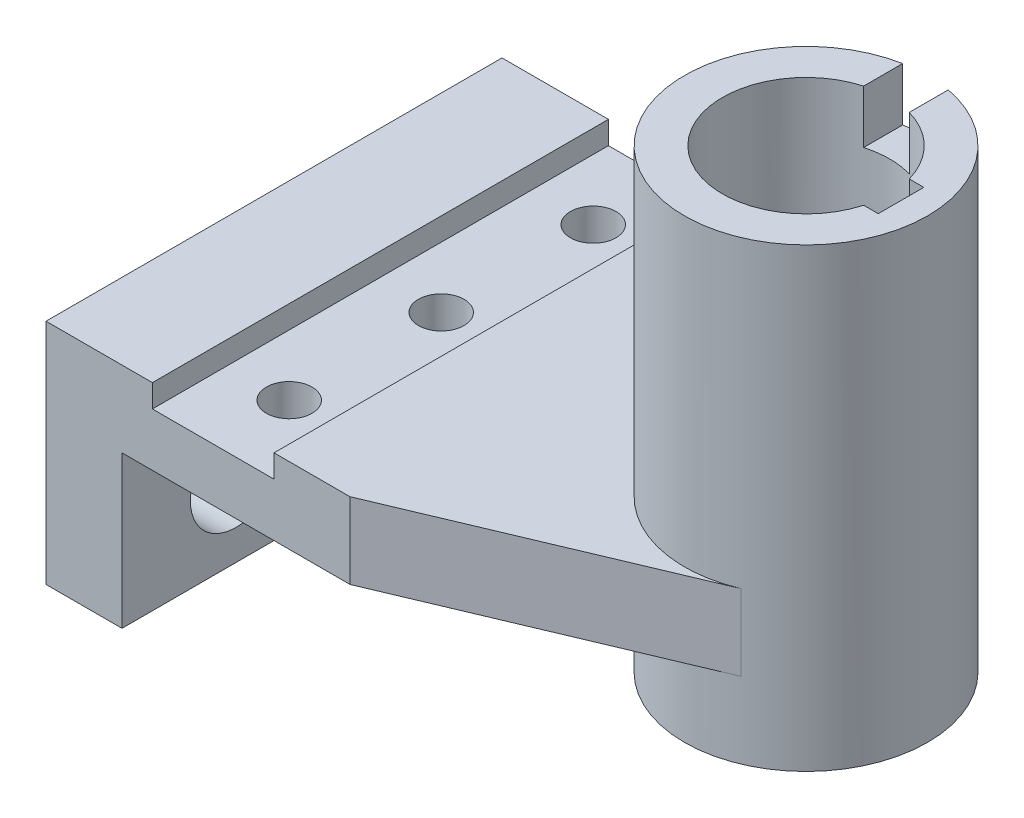
from build123d import *
from build123d.topology import SkipClean

# Parameters (mm, degrees)
BOSS_EXTRUDE1_DEPTH      = 60
SKETCH3_R                = 6.000000000000003
SKETCH3_R_2              = 5.999999999999998
CUT_EXTRUDE1_DEPTH       = 10
SKETCH4_R                = 3.0000000000000027
SKETCH4_R_2              = 3.0000000000000004
SKETCH4_R_3              = 2.9999999999999996
CUT_EXTRUDE2_DEPTH       = 7
BOSS_EXTRUDE2_DEPTH      = 40
BOSS_EXTRUDE2_DEPTH_BACK = 20
CUT_EXTRUDE3_DEPTH       = 90.70884954089212
CUT_EXTRUDE3_DEPTH_BACK  = 40
BOSS_EXTRUDE3_DEPTH      = 10
CUT_EXTRUDE4_START       = -60
SKETCH9_R                = 10.999999999999993
CUT_EXTRUDE4_DEPTH       = 60
CUT_EXTRUDE5_DEPTH       = 60
SKETCH9_4_W              = 6
SKETCH9_4_H              = 24.979661142970425
CUT_EXTRUDE6_DEPTH       = 7


with BuildPart() as part:
    # Sketch2 → Boss-Extrude1 (new body)
    with BuildSketch(Plane.XY):
        Polygon((-32.63636363636363, -18.753246753246753), (-32.63636363636363, 11.246753246753245), (-18.636363636363633, 11.246753246753245), (-18.636363636363633, 8.246753246753245), (-2.6363636363636314, 8.246753246753245), (-2.6363636363636314, 11.246753246753245), (37.363636363636374, 11.246753246753245), (37.363636363636374, 1.2467532467532443), (-22.636363636363637, 1.2467532467532365), (-22.63636363636363, -18.75324675324675), align=None)
    extrude(amount=BOSS_EXTRUDE1_DEPTH)

    # Sketch3 → Cut-Extrude1 (cut)
    with BuildSketch(Plane.ZY.offset(32.63636363636363)):
        with Locations((45, -8.753246753246755)):
            Circle(SKETCH3_R)
        with Locations((15, -8.753246753246755)):
            Circle(SKETCH3_R_2)
    extrude(amount=-CUT_EXTRUDE1_DEPTH, mode=Mode.SUBTRACT)

    # Sketch4 → Cut-Extrude2 (cut)
    with BuildSketch(Plane(origin=(0, 8.246753246753245, 0), x_dir=(1, 0, 0), z_dir=(0, 1, 0))):
        with Locations(Location((-10.63636363636363, -49.99999999999999, 0), (0, 0, 270))):
            Circle(SKETCH4_R)
        with Locations(Location((-10.636363636363631, -9.999999999999995, 0), (0, 0, 270))):
            Circle(SKETCH4_R_2)
        with Locations(Location((-10.63636363636363, -29.999999999999996, 0), (0, 0, 270))):
            Circle(SKETCH4_R_3)
    extrude(amount=-CUT_EXTRUDE2_DEPTH, mode=Mode.SUBTRACT)

    # Sketch5 → Boss-Extrude2 (add, two sides: drawn at the far end of the back side and taken through both)
    with BuildSketch(Plane(origin=(0, 11.246753246753245, 0), x_dir=(1, 0, 0), z_dir=(0, 1, 0)).offset(-BOSS_EXTRUDE2_DEPTH_BACK)):
        with BuildLine():
            ThreePointArc((37.36363636363612, -46), (40.532227080018274, -45.6831129841004), (43.57530713931024, -44.745004109007205))
            ThreePointArc((43.57530713931024, -44.745004109007205), (50.693803887167014, -38.849103558813695), (53.363636363636374, -30.000000000000004))
            ThreePointArc((53.363636363636374, -30), (50.693803887167014, -21.150896441186312), (43.57530713931025, -15.254995890992799))
            ThreePointArc((43.57530713931025, -15.254995890992799), (40.53222708001828, -14.316887015899601), (37.36363636363611, -13.999999999999996))
            Line((37.363636363636374, -14), (37.363636363636374, -19.000000000000007))
            ThreePointArc((37.36363636363639, -19.000000000000007), (45.141810956688396, -22.22182540694799), (48.36363636363637, -30))
            ThreePointArc((48.36363636363637, -30.000000000000004), (45.14181095668839, -37.77817459305202), (37.363636363636374, -40.99999999999999))
            Line((37.363636363636374, -40.99999999999999), (37.363636363636374, -46))
        make_face()
        with BuildLine():
            ThreePointArc((37.36363636363611, -13.999999999999996), (21.36363636363637, -29.999999999999996), (37.36363636363612, -46))
            Line((37.363636363636374, -46), (37.363636363636374, -40.99999999999999))
            ThreePointArc((37.363636363636374, -40.99999999999999), (26.36363636363638, -29.99999999999999), (37.36363636363639, -19.000000000000007))
            Line((37.363636363636374, -19.000000000000007), (37.363636363636374, -14))
        make_face()
    extrude(amount=BOSS_EXTRUDE2_DEPTH + BOSS_EXTRUDE2_DEPTH_BACK)

    # Sketch5<4> → Cut-Extrude3 (cut, two sides: drawn at the far end of the back side and taken through both)
    with BuildSketch(Plane(origin=(0, 11.246753246753245, 0), x_dir=(1, 0, 0), z_dir=(0, 1, 0)).offset(-CUT_EXTRUDE3_DEPTH_BACK)):
        Polygon((7.363636363636369, 0), (37.36363636363637, -12.638187272961233), (37.363636363636374, 0), align=None)
        Polygon((37.363636363636374, -47.36181272703875), (7.36363636363637, -60), (37.363636363636374, -60), align=None)
    extrude(amount=CUT_EXTRUDE3_DEPTH + CUT_EXTRUDE3_DEPTH_BACK, mode=Mode.SUBTRACT)

    # Sketch7 → Boss-Extrude3 (add)
    with BuildSketch(Plane(origin=(0, 11.246753246753245, 0), x_dir=(1, 0, 0), z_dir=(0, 1, 0))):
        Polygon((37.363636363636374, -12.638187272961241), (43.57530713931025, -15.254995890992793), (43.57530713931024, -44.7450041090072), (37.363636363636374, -47.361812727038746), align=None)
    extrude(amount=-BOSS_EXTRUDE3_DEPTH)

    # Sketch9 → Cut-Extrude4 (cut)
    with SkipClean():  # the faces are left unmerged after this step: merging them gives an invalid solid
        with BuildSketch(Plane(origin=(0, 51.24675324675325, 0), x_dir=(1, 0, 0), z_dir=(0, 1, 0)).offset(CUT_EXTRUDE4_START)):
            with Locations(Location((37.363636363636374, -30, 0), (0, 0, 270))):
                Circle(SKETCH9_R)
        extrude(amount=CUT_EXTRUDE4_DEPTH, mode=Mode.SUBTRACT)

    # Sketch9<3> → Cut-Extrude5 (cut)
    with BuildSketch(Plane(origin=(0, 51.24675324675325, 0), x_dir=(1, 0, 0), z_dir=(0, 1, 0))):
        Polygon((49.86363636363637, -27), (49.86363636363636, -33), (47.38496613189031, -32.99999999999999), (47.38496613189031, -27), align=None)
    extrude(amount=-CUT_EXTRUDE5_DEPTH, mode=Mode.SUBTRACT)

    # Sketch9<4> → Cut-Extrude6 (cut)
    with BuildSketch(Plane(origin=(0, 51.24675324675325, 0), x_dir=(1, 0, 0), z_dir=(0, 1, 0))):
        with Locations((37.363636363636374, -17.510169428514793)):
            Rectangle(SKETCH9_4_W, SKETCH9_4_H)
    extrude(amount=-CUT_EXTRUDE6_DEPTH, mode=Mode.SUBTRACT)


solid = part.part
